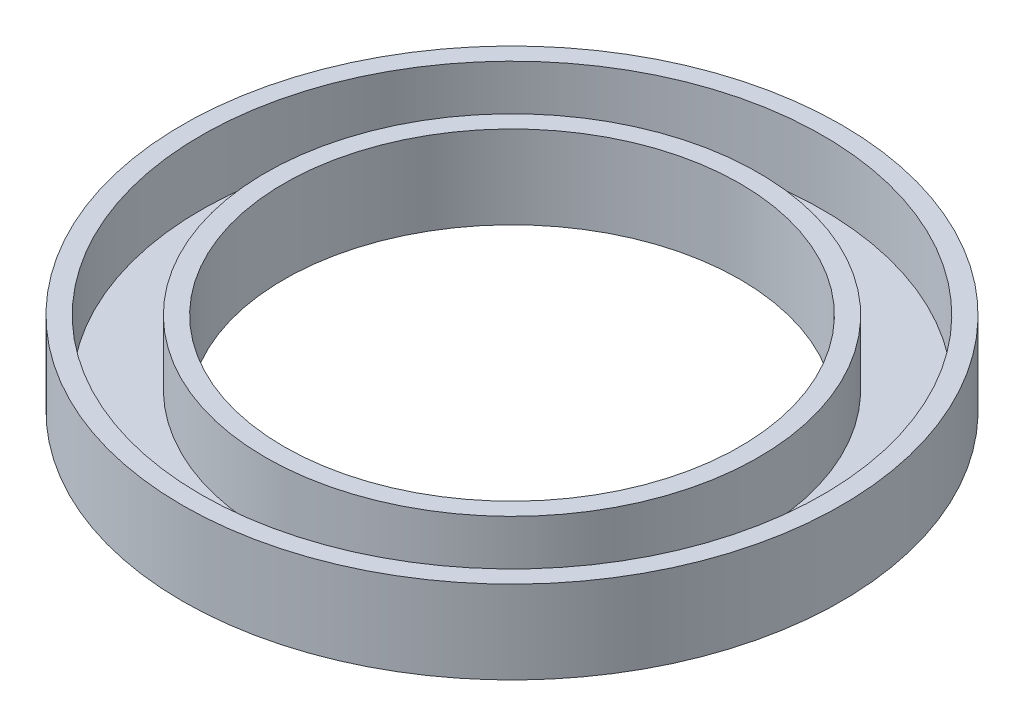
from build123d import *


with BuildPart() as part:
    # 草图1 → 旋转1 (revolve)
    with BuildSketch(Plane.XY, mode=Mode.PRIVATE) as revolve_1_sk:
        Polygon((19.9, 17.277214827), (19.9, 12.077214827), (25.1, 12.077214827), (25.1, 17.277214827), (26.6, 17.277214827), (26.6, 10.577214827), (18.4, 10.577214827), (18.4, 17.277214827), align=None)
    revolve(revolve_1_sk.sketch.rotate(Axis((0, 46.726906893, 0), (0, -1, 0)), 90), axis=Axis((0, 46.726906893, 0), (0, -1, 0)))


solid = part.part
